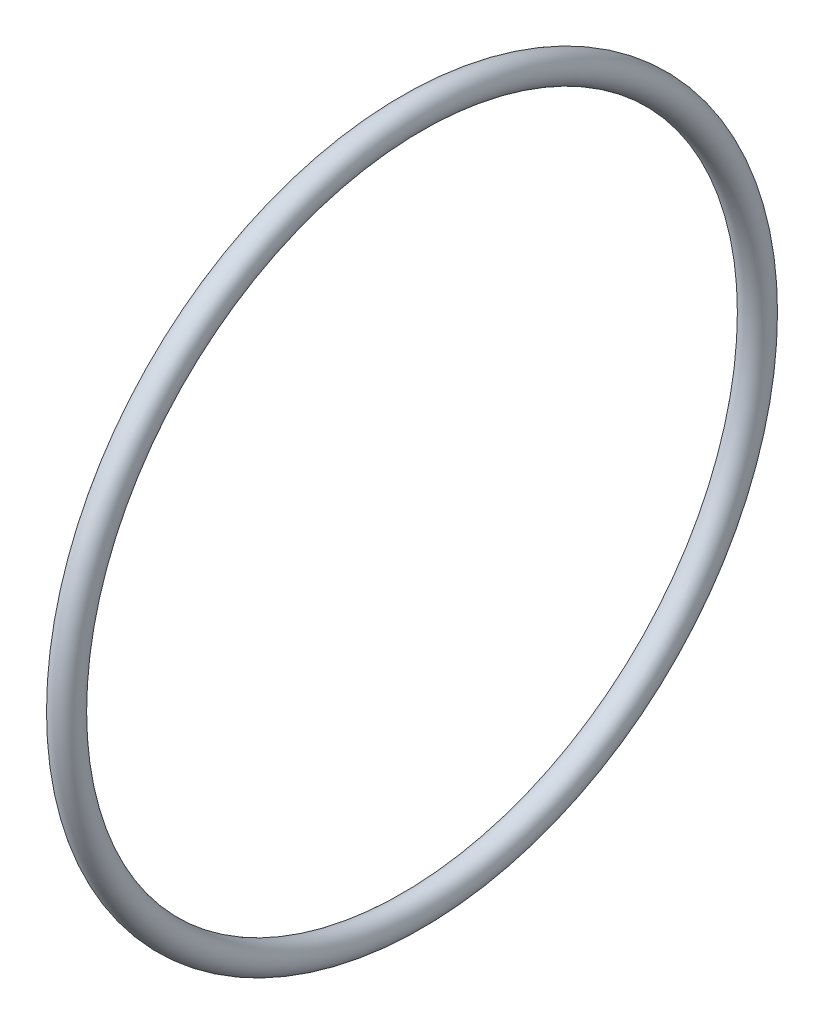
from build123d import *

# Parameters (mm, degrees)
SKETCH_1_R = 1.5


with BuildPart() as part:
    # 草图1 → 旋转2 (revolve)
    with BuildSketch(Plane.XY, mode=Mode.PRIVATE) as revolve_2_sk:
        with Locations((0, 36.5)):
            Circle(SKETCH_1_R)
    revolve(revolve_2_sk.sketch.rotate(Axis((-30.558876756, 0, 0), (1, 0, 0)), 90), axis=Axis((-30.558876756, 0, 0), (1, 0, 0)))


solid = part.part
